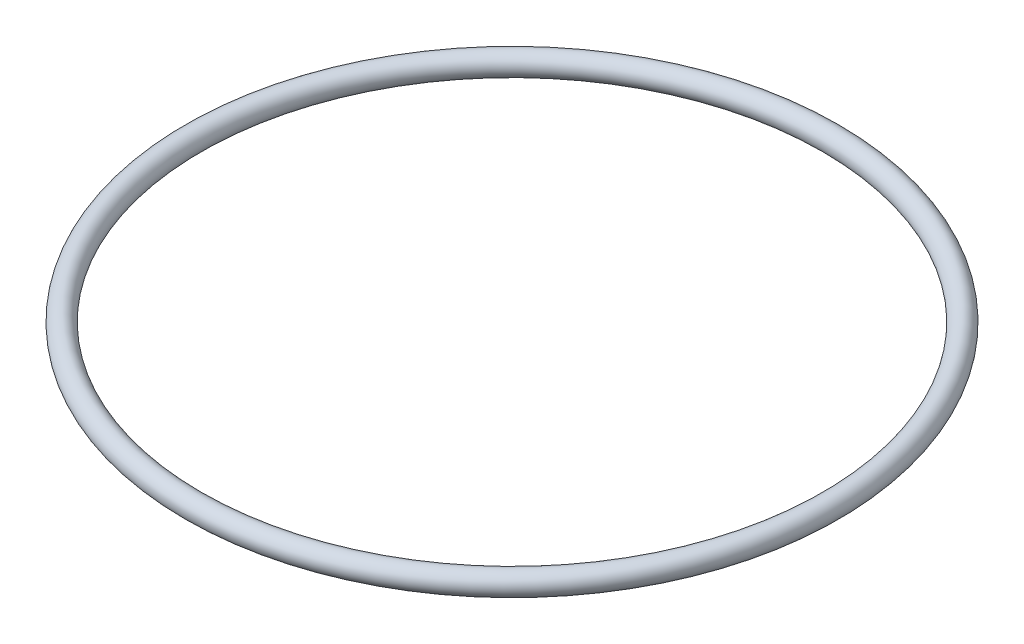
from build123d import *

# Parameters (mm, degrees)
IZIM1_R = 1.765


with BuildPart() as part:
    # Çizim1 → Döndür1 (revolve)
    with BuildSketch(Plane.XY, mode=Mode.PRIVATE) as d_nd_r1_sk:
        with Locations((-50.775, 0)):
            Circle(IZIM1_R)
    revolve(d_nd_r1_sk.sketch.rotate(Axis((0, 0, 0), (0, 1, 0)), 270), axis=Axis((0, 0, 0), (0, 1, 0)))


solid = part.part
